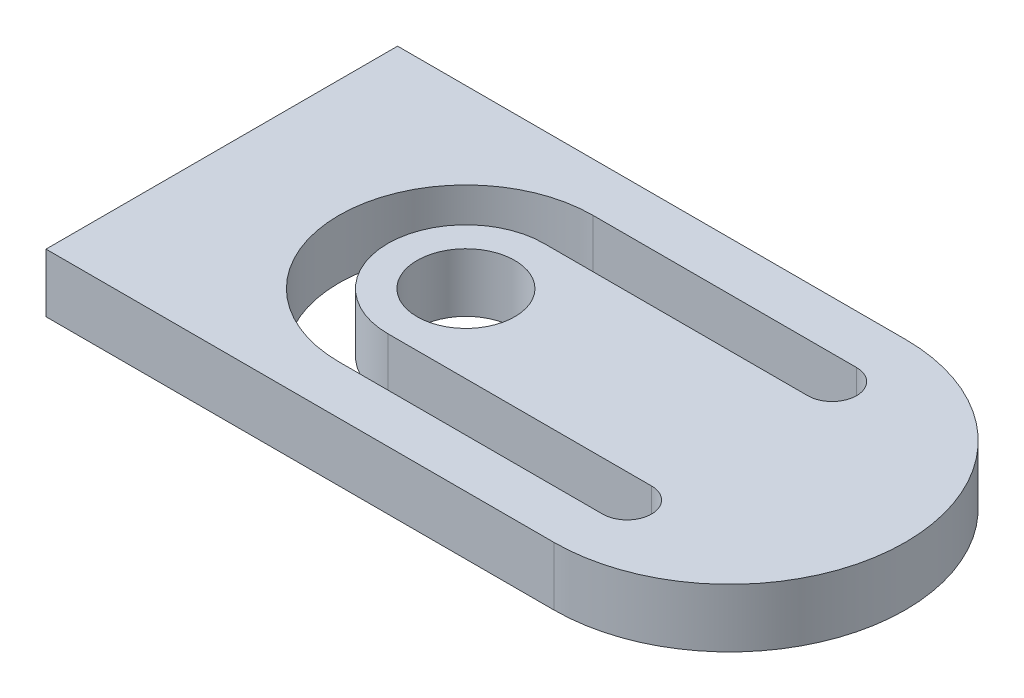
from build123d import *

# Parameters (mm, degrees)
SKETCH1_R           = 2.5
BOSS_EXTRUDE2_DEPTH = 3


with BuildPart() as part:
    # Sketch1 → Boss-Extrude2 (new body)
    with BuildSketch(Plane(origin=(0, 0, 0), x_dir=(1, 0, 0), z_dir=(0, 1, 0))):
        with BuildLine():
            Line((-19.356020942, 9), (6.643979058, 9))
            ThreePointArc((6.643979058, 9), (15.643979058, 0), (6.643979058, -9))
            Line((6.643979058, -9), (-19.356020942, -9))
            Line((-19.356020942, -9), (-19.356020942, 9))
        make_face()
        with Locations(Location((-6.856020942, 0, 0), (0, 0, 270))):
            Circle(SKETCH1_R, mode=Mode.SUBTRACT)
        with BuildLine():
            Line((-6.856020942, -6.5), (6.643979058, -6.5))
            ThreePointArc((6.643979058, -6.5), (7.893979058, -5.25), (6.643979058, -4))
            Line((6.643979058, -4), (-6.856020942, -4))
            ThreePointArc((-6.856020942, -4), (-10.856020942, 0), (-6.856020942, 4))
            Line((-6.856020942, 4), (6.643979058, 4))
            ThreePointArc((6.643979058, 4), (7.893979058, 5.25), (6.643979058, 6.5))
            Line((6.643979058, 6.5), (-6.856020942, 6.5))
            ThreePointArc((-6.856020942, 6.5), (-13.356020942, 0), (-6.856020942, -6.5))
        make_face(mode=Mode.SUBTRACT)
    extrude(amount=BOSS_EXTRUDE2_DEPTH)


solid = part.part
